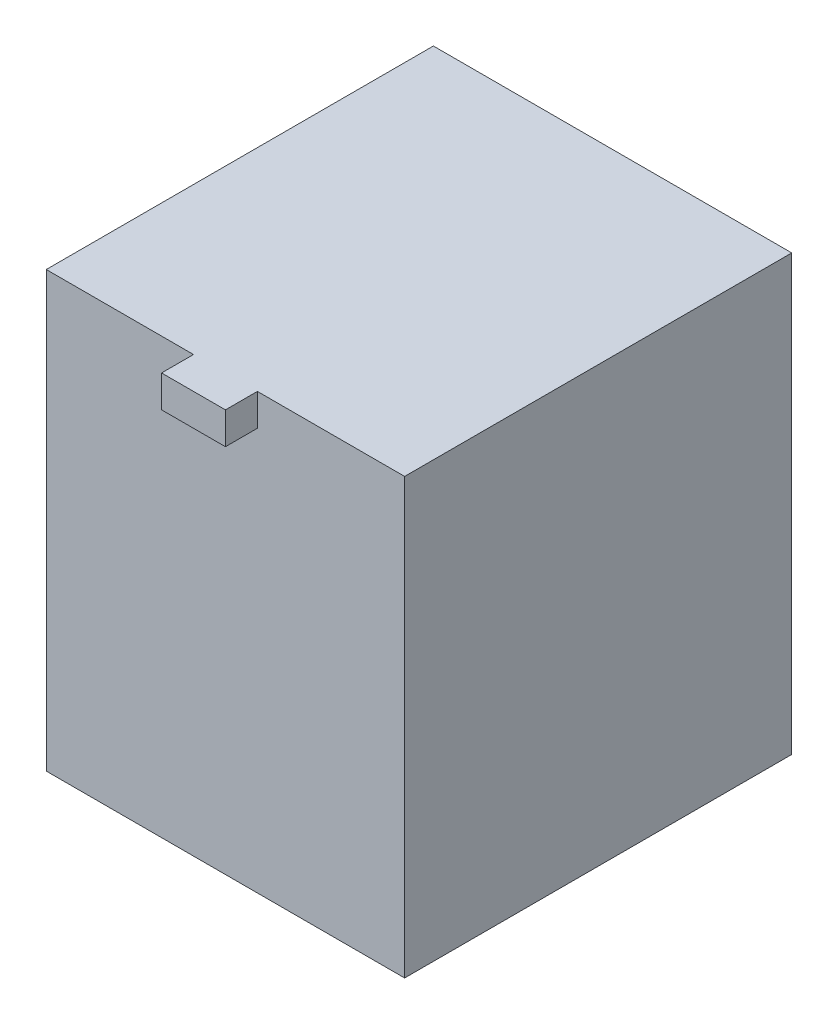
from build123d import *

# Parameters (mm, degrees)
SKETCH_1_W      = 56.1
SKETCH_1_H      = 60.6
EXTRUDE_1_DEPTH = 68
SKETCH_2_W      = 5
SKETCH_2_H      = 5
EXTRUDE_2_DEPTH = 5


with BuildPart() as part:
    # 草图1 → 凸台-拉伸1 (new body)
    with BuildSketch(Plane(origin=(0, 0, 0), x_dir=(1, 0, 0), z_dir=(0, 1, 0))):
        Rectangle(SKETCH_1_W, SKETCH_1_H)
    extrude(amount=EXTRUDE_1_DEPTH)

    # 草图2 → 凸台-拉伸2 (add)
    with BuildSketch(Plane.XY.offset(30.3)):
        with Locations((-2.5, 65.5)):
            Rectangle(SKETCH_2_W, SKETCH_2_H)
        with Locations((2.5, 65.5)):
            Rectangle(SKETCH_2_W, SKETCH_2_H)
    extrude(amount=EXTRUDE_2_DEPTH)


solid = part.part
